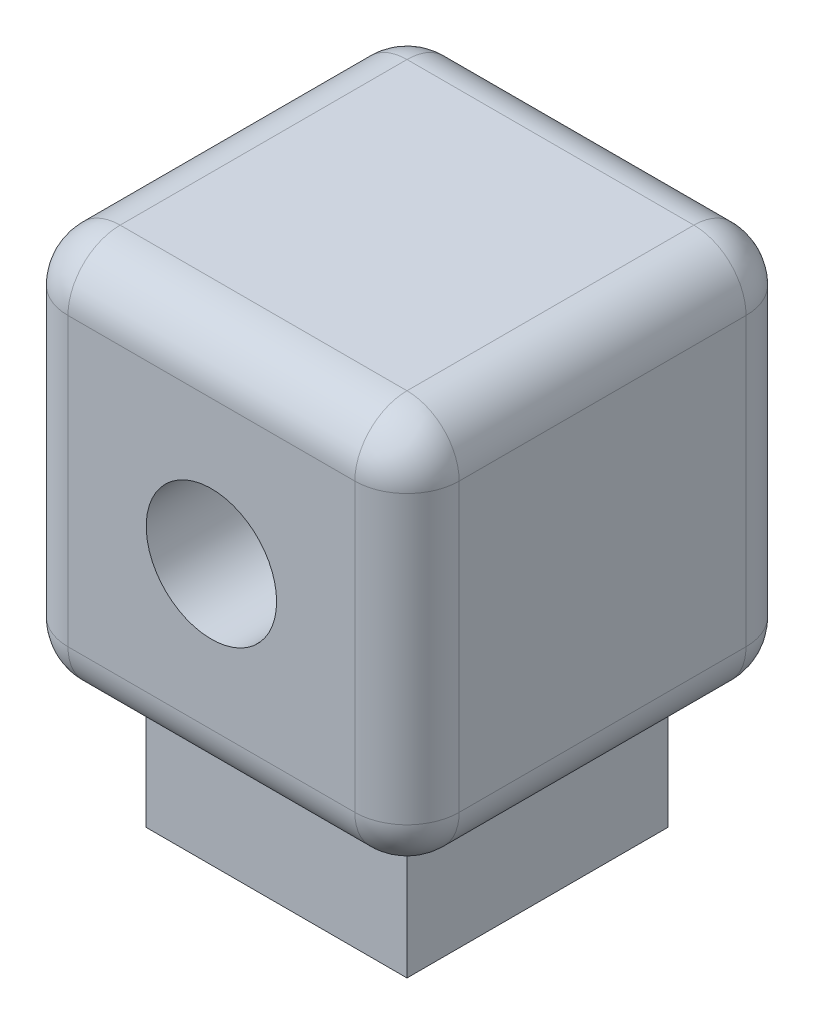
from build123d import *

# Parameters (mm, degrees)
SKETCH1_W           = 15
SKETCH1_H           = 15
BOSS_EXTRUDE1_DEPTH = 15
SKETCH2_W           = 10
SKETCH2_H           = 10
BOSS_EXTRUDE2_DEPTH = 5
SKETCH3_R           = 2.5
CUT_EXTRUDE1_DEPTH  = 25.852419528
FILLET1_R           = 2


with BuildPart() as part:
    # Sketch1 → Boss-Extrude1 (new body)
    with BuildSketch(Plane(origin=(0, 0, 0), x_dir=(1, 0, 0), z_dir=(0, 1, 0))):
        with Locations((5.447693091, -2.5)):
            Rectangle(SKETCH1_W, SKETCH1_H)
    extrude(amount=BOSS_EXTRUDE1_DEPTH)

    # Sketch2 → Boss-Extrude2 (add)
    with BuildSketch(Plane.XZ):
        with Locations((5.447693091, 2.5)):
            Rectangle(SKETCH2_W, SKETCH2_H)
    extrude(amount=BOSS_EXTRUDE2_DEPTH)

    # Sketch3 → Cut-Extrude1 (cut, through all)
    with BuildSketch(Plane.XY.offset(10)):
        with Locations((5.447693091, 7.5)):
            Circle(SKETCH3_R)
    extrude(amount=-CUT_EXTRUDE1_DEPTH, mode=Mode.SUBTRACT)

    # Fillet1
    fillet1_edges = [part.edges().sort_by_distance(p)[0] for p in [
        (-2.052306909, 15, 2.5),
        (5.447693091, 15, 10),
        (12.947693091, 15, 2.5),
        (5.447693091, 0, 10),
        (-2.052306909, 0, 2.5),
        (5.447693091, 0, -5),
        (12.947693091, 0, 2.5),
        (12.947693091, 7.5, 10),
        (-2.052306909, 7.5, 10),
        (-2.052306909, 7.5, -5),
        (12.947693091, 7.5, -5),
        (5.447693091, 15, -5),
    ]]
    fillet(fillet1_edges, radius=FILLET1_R)


solid = part.part
